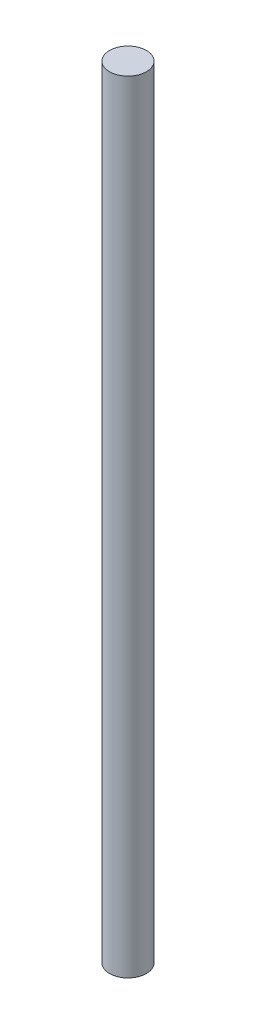
from build123d import *

# Parameters (mm, degrees)
SKETCH1_R           = 6
BOSS_EXTRUDE1_DEPTH = 254


with BuildPart() as part:
    # Sketch1 → Boss-Extrude1 (new body)
    with BuildSketch(Plane(origin=(0, 0, 0), x_dir=(1, 0, 0), z_dir=(0, 1, 0))):
        with Locations(Location((0, 0, 0), (0, 0, 270))):
            Circle(SKETCH1_R)
    extrude(amount=BOSS_EXTRUDE1_DEPTH)


solid = part.part
